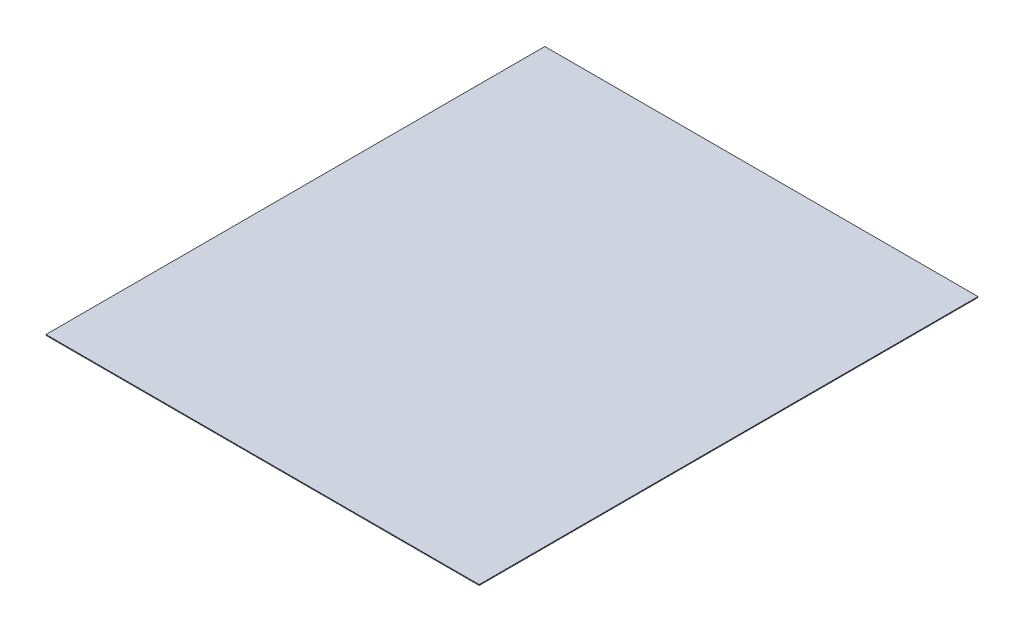
from build123d import *

# Parameters (mm, degrees)
SKETCH1_W           = 1676.4
SKETCH1_H           = 1930.4
BOSS_EXTRUDE1_DEPTH = 3.175


with BuildPart() as part:
    # Sketch1 → Boss-Extrude1 (new body)
    with BuildSketch(Plane(origin=(0, 0, 0), x_dir=(1, 0, 0), z_dir=(0, 1, 0))):
        with Locations((-37.582817798, 47.954699334)):
            Rectangle(SKETCH1_W, SKETCH1_H)
    extrude(amount=BOSS_EXTRUDE1_DEPTH)


solid = part.part
